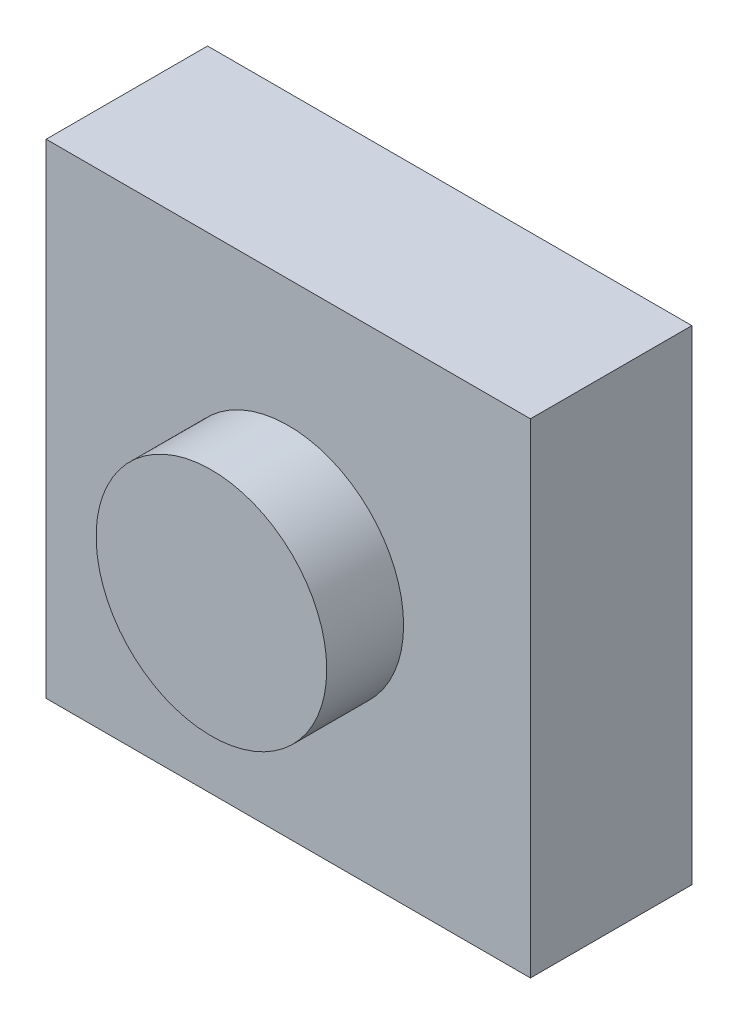
from build123d import *

# Parameters (mm, degrees)
CROQUIS1_W              = 6.3
CROQUIS1_H              = 6.3
SALIENTE_EXTRUIR1_DEPTH = 2.1
CROQUIS2_R              = 1.5
SALIENTE_EXTRUIR2_DEPTH = 1


with BuildPart() as part:
    # Croquis1 → Saliente-Extruir1 (new body)
    with BuildSketch(Plane.XY):
        Rectangle(CROQUIS1_W, CROQUIS1_H)
    extrude(amount=SALIENTE_EXTRUIR1_DEPTH)

    # Croquis2 → Saliente-Extruir2 (add)
    with BuildSketch(Plane.XY.offset(2.1)):
        Circle(CROQUIS2_R)
    extrude(amount=SALIENTE_EXTRUIR2_DEPTH)


solid = part.part
